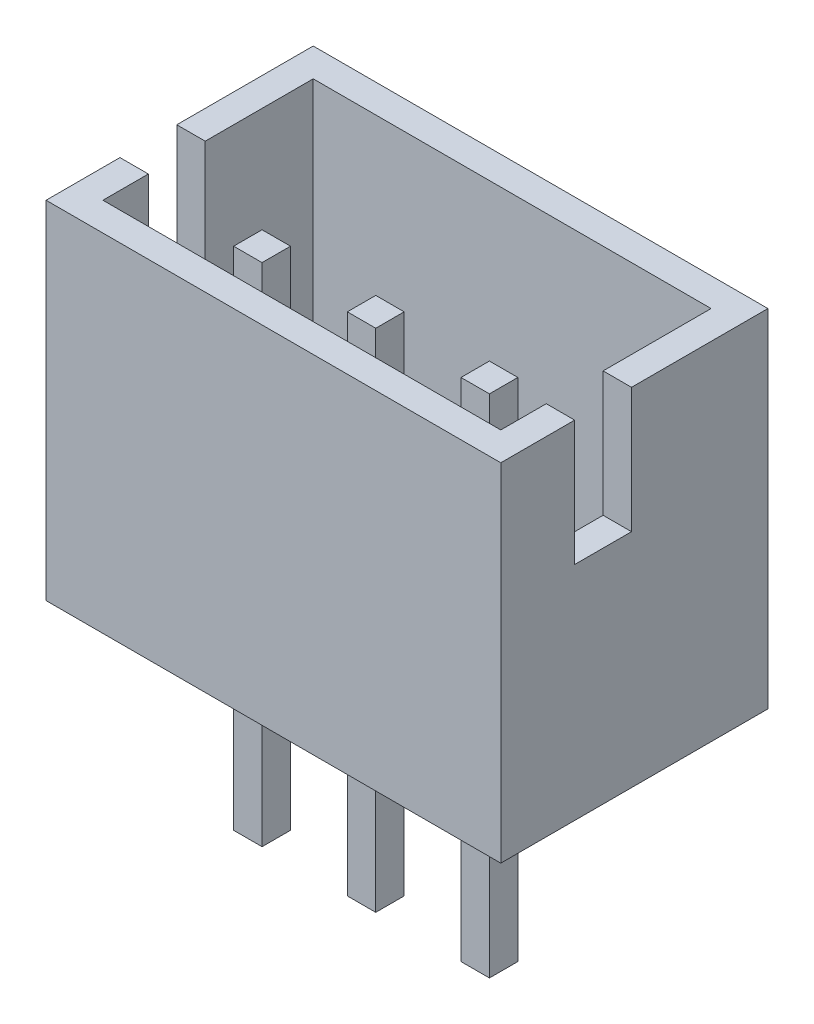
from build123d import *

# Parameters (mm, degrees)
SKETCH1_W                  = 8
SKETCH1_H                  = 4.7
BOSS_EXTRUDE1_DEPTH        = 6.1
SHELL1_T                   = -0.5
BOSS_EXTRUDE2_DEPTH        = 5
BOSS_EXTRUDE2_DEPTH_BACK   = 3.9
SKETCH2_W                  = 0.5
SKETCH2_H                  = 0.5
BOSS_EXTRUDE2_2_DEPTH      = 5
BOSS_EXTRUDE2_2_DEPTH_BACK = 3.9
BOSS_EXTRUDE2_3_DEPTH      = 5
BOSS_EXTRUDE2_3_DEPTH_BACK = 3.9
SKETCH3_W                  = 1
SKETCH3_H                  = 2.2
CUT_EXTRUDE1_DEPTH         = 7.5


with BuildPart() as part:
    # Sketch1 → Boss-Extrude1 (new body)
    with BuildSketch(Plane(origin=(0, 0, 0), x_dir=(1, 0, 0), z_dir=(0, 1, 0))):
        Rectangle(SKETCH1_W, SKETCH1_H)
    extrude(amount=BOSS_EXTRUDE1_DEPTH)

    # Shell1
    shell1_openings = [part.faces().sort_by_distance(p)[0] for p in [
        (0, 6.1, 0),
    ]]
    offset(amount=SHELL1_T, openings=shell1_openings, kind=Kind.INTERSECTION)

    # Sketch3 → Cut-Extrude1 (cut)
    with BuildSketch(Plane.ZY.offset(4)):
        with Locations((0.55, 5)):
            Rectangle(SKETCH3_W, SKETCH3_H)
    cut_extrude1 = extrude(amount=-CUT_EXTRUDE1_DEPTH, mode=Mode.SUBTRACT)

    # Mirror1: Cut-Extrude1 across plane
    add(cut_extrude1.mirror(Plane(origin=(0, 0, 0), x_dir=(0, 0, 1), z_dir=(1, 0, 0))), mode=Mode.SUBTRACT)


with BuildPart() as body_2:
    # Sketch2 → Boss-Extrude2 (new, two sides: drawn at the far end of the back side and taken through both)
    with BuildSketch(Plane(origin=(0, 0.5, 0), x_dir=(1, 0, 0), z_dir=(0, 1, 0)).offset(-BOSS_EXTRUDE2_DEPTH_BACK)):
        with Locations((0, -0.55)):
            Rectangle(SKETCH2_W, SKETCH2_H)
    extrude(amount=BOSS_EXTRUDE2_DEPTH + BOSS_EXTRUDE2_DEPTH_BACK)


with BuildPart() as body_3:
    # Sketch2 → Boss-Extrude2 2 (new, two sides: drawn at the far end of the back side and taken through both)
    with BuildSketch(Plane(origin=(0, 0.5, 0), x_dir=(1, 0, 0), z_dir=(0, 1, 0)).offset(-BOSS_EXTRUDE2_2_DEPTH_BACK)):
        with Locations((-2, -0.55)):
            Rectangle(SKETCH2_W, SKETCH2_H)
    extrude(amount=BOSS_EXTRUDE2_2_DEPTH + BOSS_EXTRUDE2_2_DEPTH_BACK)


with BuildPart() as body_4:
    # Sketch2 → Boss-Extrude2 3 (new, two sides: drawn at the far end of the back side and taken through both)
    with BuildSketch(Plane(origin=(0, 0.5, 0), x_dir=(1, 0, 0), z_dir=(0, 1, 0)).offset(-BOSS_EXTRUDE2_3_DEPTH_BACK)):
        with Locations((2, -0.55)):
            Rectangle(SKETCH2_W, SKETCH2_H)
    extrude(amount=BOSS_EXTRUDE2_3_DEPTH + BOSS_EXTRUDE2_3_DEPTH_BACK)


solid = Compound([part.part, body_2.part, body_3.part, body_4.part])
